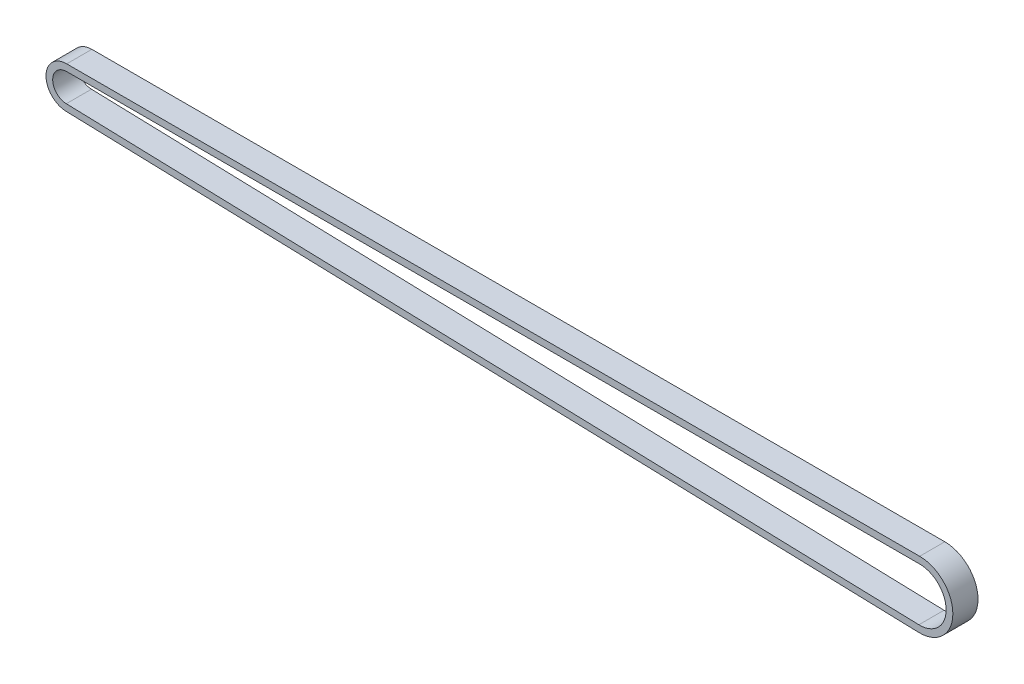
from build123d import *

# Parameters (mm, degrees)
BOSS_EXTRUDE1_DEPTH = 9.525


with BuildPart() as part:
    # Sketch1 → Boss-Extrude1 (new body)
    with BuildSketch(Plane.XY):
        with BuildLine():
            Line((0, 7.8486), (322.965447137, 7.8486))
            ThreePointArc((322.965447137, 7.8486), (335.537102143, -4.908300561), (322.597685361, -17.292020311))
            Line((322.597685361, -17.292020311), (-0.229572503, -7.84524177))
            ThreePointArc((-0.229572503, -7.84524177), (-7.847760398, 0.114798532), (0, 7.8486))
        make_face()
        with BuildLine():
            Line((0, 5.3086), (322.965447137, 5.3086))
            ThreePointArc((322.965447137, 5.3086), (332.997373859, -4.871148933), (322.671980669, -14.753107117))
            Line((322.671980669, -14.753107117), (-0.155277195, -5.306328576))
            ThreePointArc((-0.155277195, -5.306328576), (-5.308032114, 0.077646904), (0, 5.3086))
        make_face(mode=Mode.SUBTRACT)
    extrude(amount=BOSS_EXTRUDE1_DEPTH)


solid = part.part
